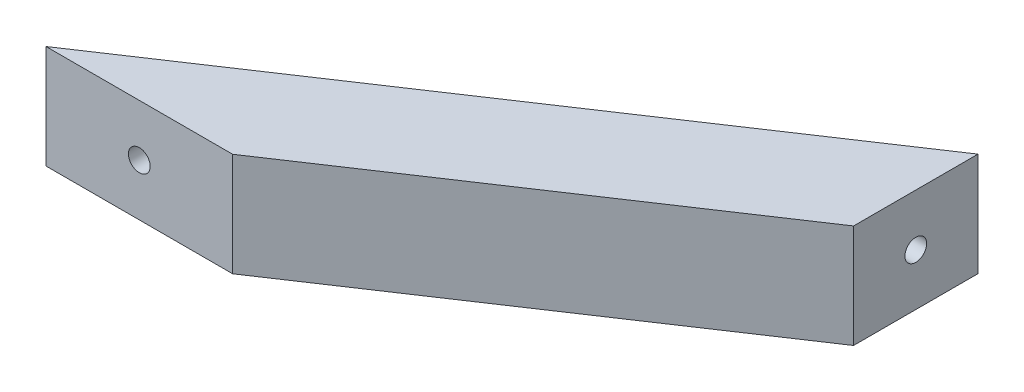
from build123d import *

# Parameters (mm, degrees)
EXTRUDE_1_DEPTH     = 20
SKETCH_2_R          = 2.1
CUT_EXTRUDE_2_DEPTH = 132.364611302
SKETCH_6_R          = 2.1
CUT_EXTRUDE_3_DEPTH = 117.990020748


with BuildPart() as part:
    # 草图1 → 凸台-拉伸1 (new body)
    with BuildSketch(Plane(origin=(0, 0, 0), x_dir=(1, 0, 0), z_dir=(0, 1, 0))):
        Polygon((90, 72.018504252), (-18.027756377, 0), (18.027756377, 0), (90, 47.981495748), align=None)
    extrude(amount=EXTRUDE_1_DEPTH)

    # 草图2 → 切除-拉伸2 (cut, through all)
    with BuildSketch(Plane(origin=(90, 0, 0), x_dir=(0, 0, -1), z_dir=(1, 0, 0))):
        with Locations((60, 10)):
            Circle(SKETCH_2_R)
    extrude(amount=-CUT_EXTRUDE_2_DEPTH, mode=Mode.SUBTRACT)

    # 草图6 → 切除-拉伸3 (cut, through all)
    with BuildSketch(Plane.XY):
        with Locations((0, 10)):
            Circle(SKETCH_6_R)
    extrude(amount=-CUT_EXTRUDE_3_DEPTH, mode=Mode.SUBTRACT)


solid = part.part
